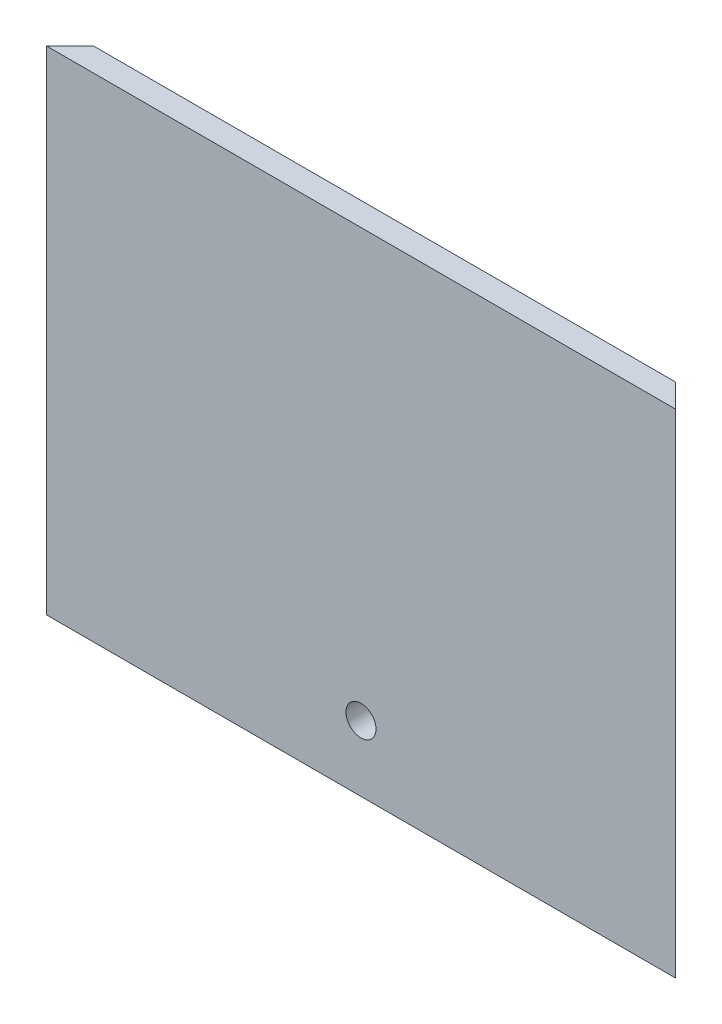
from build123d import *

# Parameters (mm, degrees)
BOSS_EXTRUDE1_DEPTH = 52.5
CUT_EXTRUDE1_DEPTH  = 63.327762674


with BuildPart() as part:
    # Sketch2 → Boss-Extrude1 (new body)
    with BuildSketch(Plane(origin=(0, 0, 0), x_dir=(1, 0, 0), z_dir=(0, 1, 0))):
        Polygon((-31, 1.25), (-33.5, -1.25), (33.5, -1.25), (31, 1.25), align=None)
    extrude(amount=BOSS_EXTRUDE1_DEPTH)

    # Sketch3 → Cut-Extrude1 (cut, through all)
    with BuildSketch(Plane.XY.offset(1.25)):
        with BuildLine():
            ThreePointArc((0, 8.6), (-1.6, 7), (0, 5.4))
            Line((0, 5.4), (0, 8.6))
        make_face()
        with BuildLine():
            Line((0, 8.6), (0, 5.4))
            ThreePointArc((0, 5.4), (1.13137085, 5.86862915), (1.6, 7))
            ThreePointArc((1.6, 7), (1.13137085, 8.13137085), (0, 8.6))
        make_face()
    extrude(amount=-CUT_EXTRUDE1_DEPTH, mode=Mode.SUBTRACT)


solid = part.part
